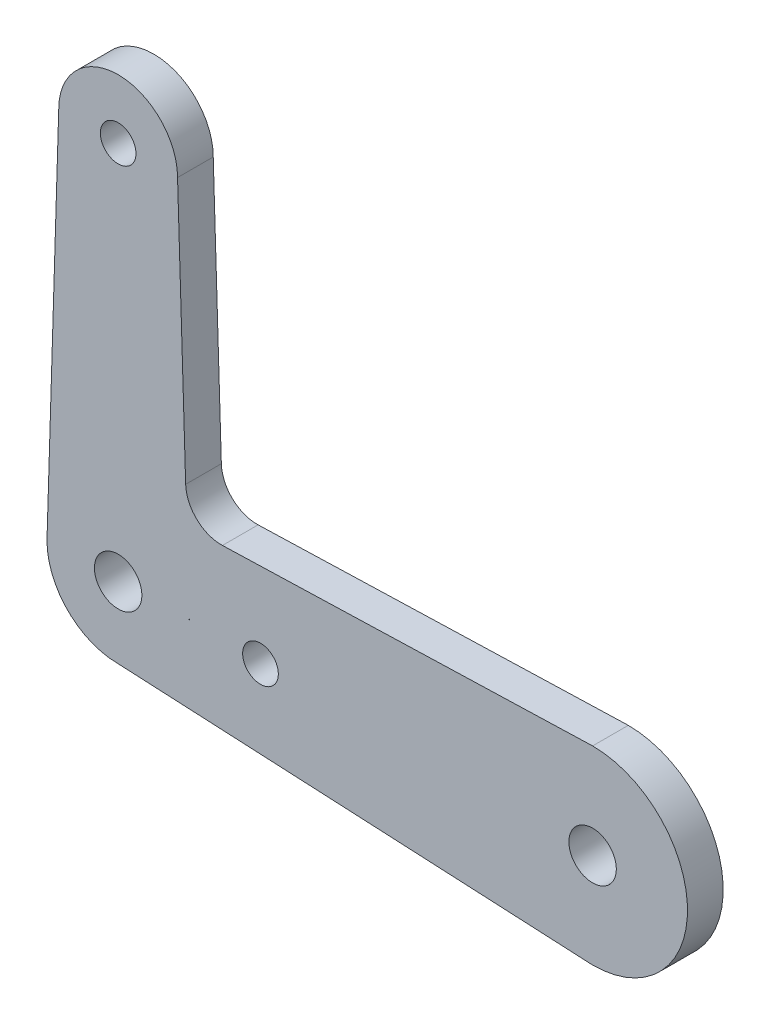
from build123d import *

# Parameters (mm, degrees)
BOSS_EXTRUDE1_DEPTH = 4.7752
FILLET1_R           = 4.7752
SKETCH2_R           = 3.175
SKETCH2_R_2         = 2.3876
CUT_EXTRUDE1_DEPTH  = 4.7752


with BuildPart() as part:
    # Sketch1 → Boss-Extrude1 (new body)
    with BuildSketch(Plane.XY):
        with BuildLine():
            ThreePointArc((7.9502, 50.8), (0, 58.7502), (-7.9502, 50.8))
            Line((-7.9502, 50.8), (-9.506710526, 0.589983026))
            Line((-9.506710526, 0.589983026), (-9.525, 0))
            ThreePointArc((-9.525, 0), (-6.735192091, -6.735192091), (0, -9.525))
            Line((0, -9.525), (62.233167082, -12.636658354))
            Line((62.233167082, -12.636658354), (63.5, -12.7))
            ThreePointArc((63.5, -12.7), (76.2, 0), (63.5, 12.7))
            Line((63.5, 12.7), (62.713355965, 12.675614035))
            Line((62.713355965, 12.675614035), (9.183498158, 11.016188443))
            Line((9.183498158, 11.016188443), (7.9502, 50.8))
        make_face()
        with BuildLine():
            ThreePointArc((9.506710526, 0.589983026), (9.520426534, 0.295133223), (9.525, 0))
            Line((9.525, 0), (9.506710526, 0.589983026))
        make_face(mode=Mode.SUBTRACT)
    extrude(amount=BOSS_EXTRUDE1_DEPTH)

    # Fillet1
    fillet1_edges = [part.edges().sort_by_distance(p)[0] for p in [
        (9.183498158, 11.016188443, 2.3876),
    ]]
    fillet(fillet1_edges, radius=FILLET1_R)

    # Sketch2 → Cut-Extrude1 (cut)
    with BuildSketch(Plane.XY.offset(4.7752)):
        Circle(SKETCH2_R)
        with Locations((0, 50.8)):
            Circle(SKETCH2_R_2)
        with Locations((19.05, 0)):
            Circle(SKETCH2_R_2)
        with Locations((63.5, 0)):
            Circle(SKETCH2_R)
    extrude(amount=-CUT_EXTRUDE1_DEPTH, mode=Mode.SUBTRACT)


solid = part.part
